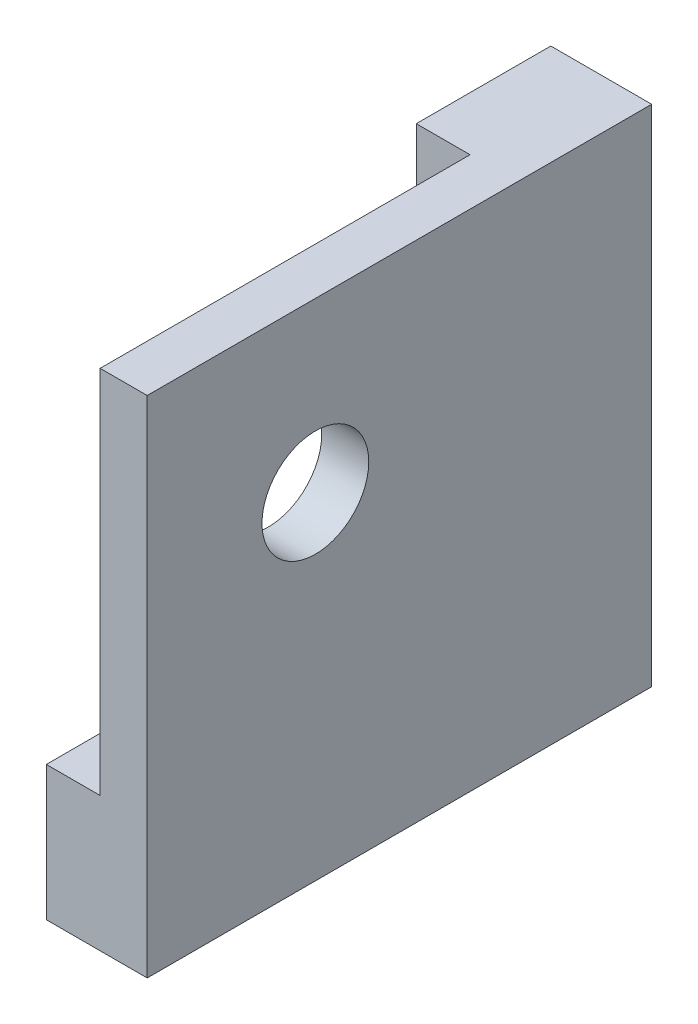
from build123d import *

# Parameters (mm, degrees)
SKETCH2_W               = 30
SKETCH2_H               = 30
SKETCH2_R               = 3.175
BOSS_EXTRUDE1_DEPTH     = 6
CUT_EXTRUDE1_DEPTH      = 43.848570571
CUT_EXTRUDE1_DEPTH_BACK = 3.2
SKETCH3_R               = 3.175


with BuildPart() as part:
    # Sketch2 → Boss-Extrude1 (new body)
    with BuildSketch(Plane(origin=(0, 0, 0), x_dir=(0, 0, -1), z_dir=(1, 0, 0))):
        with Locations((15, -15)):
            Rectangle(SKETCH2_W, SKETCH2_H)
        with Locations((10, -10)):
            Circle(SKETCH2_R, mode=Mode.SUBTRACT)
    extrude(amount=BOSS_EXTRUDE1_DEPTH)

    # Sketch3 → Cut-Extrude1 (cut, two sides: drawn at the far end of the back side and taken through both)
    with BuildSketch(Plane.ZY.offset(-CUT_EXTRUDE1_DEPTH_BACK)):
        with BuildLine():
            Line((-22, 0), (-22, -10))
            ThreePointArc((-22, -10), (-18.485281374, -18.485281374), (-10, -22))
            Line((-10, -22), (0, -22))
            Line((0, -22), (0, 0))
            Line((0, 0), (-22, 0))
        make_face()
        with Locations((-10, -10)):
            Circle(SKETCH3_R, mode=Mode.SUBTRACT)
    extrude(amount=CUT_EXTRUDE1_DEPTH + CUT_EXTRUDE1_DEPTH_BACK, mode=Mode.SUBTRACT)


solid = part.part
